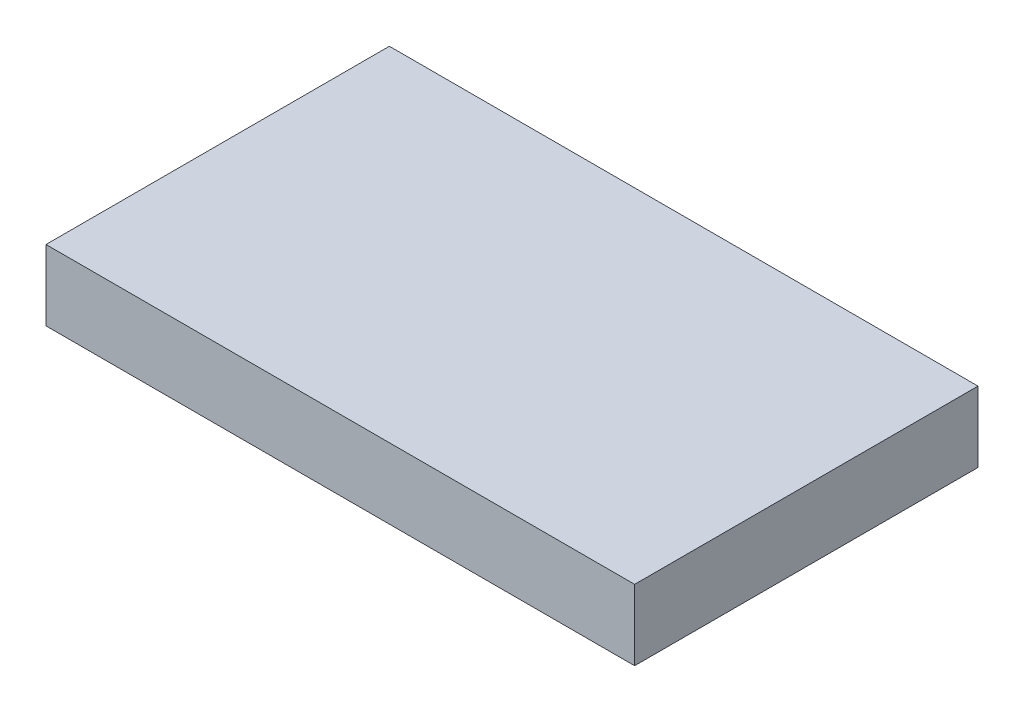
from build123d import *

# Parameters (mm, degrees)
SKETCH1_W           = 152.4
SKETCH1_H           = 88.9
BOSS_EXTRUDE1_DEPTH = 18.25625


with BuildPart() as part:
    # Sketch1 → Boss-Extrude1 (new body)
    with BuildSketch(Plane(origin=(0, 0, 0), x_dir=(1, 0, 0), z_dir=(0, 1, 0))):
        Rectangle(SKETCH1_W, SKETCH1_H)
    extrude(amount=BOSS_EXTRUDE1_DEPTH)


solid = part.part
